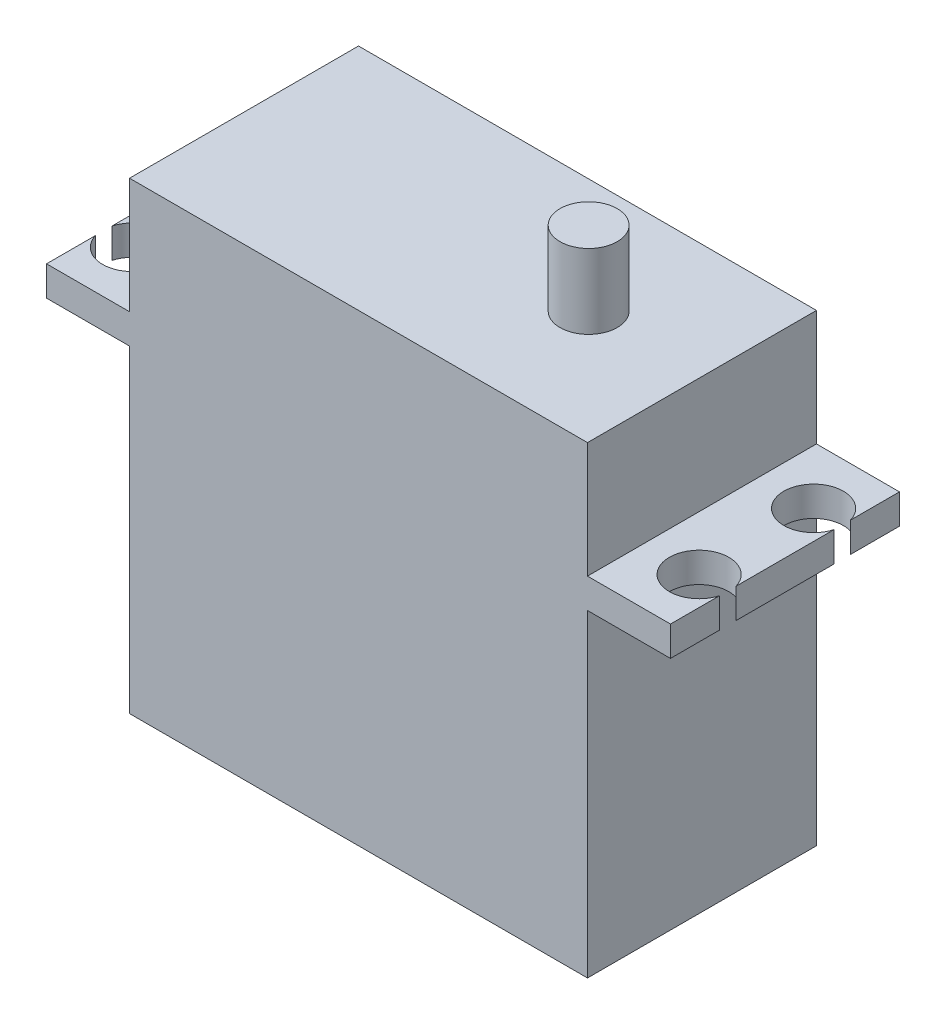
from build123d import *

# Parameters (mm, degrees)
SKETCH1_W           = 40
SKETCH1_H           = 20
BOSS_EXTRUDE1_DEPTH = 40.5
SKETCH2_R           = 2.5
BOSS_EXTRUDE2_DEPTH = 6.5
SKETCH3_W           = 20
SKETCH3_H           = 2.6
BOSS_EXTRUDE3_DEPTH = 7.25
SKETCH4_W           = 20
SKETCH4_H           = 2.6
BOSS_EXTRUDE4_DEPTH = 7.25
SKETCH5_R           = 2.6
CUT_EXTRUDE5_DEPTH  = 7.25


with BuildPart() as part:
    # Sketch1 → Boss-Extrude1 (new body)
    with BuildSketch(Plane(origin=(0, 0, 0), x_dir=(1, 0, 0), z_dir=(0, 1, 0))):
        with Locations((20, -10)):
            Rectangle(SKETCH1_W, SKETCH1_H)
    extrude(amount=BOSS_EXTRUDE1_DEPTH)

    # Sketch2 → Boss-Extrude2 (add)
    with BuildSketch(Plane(origin=(0, 40.5, 0), x_dir=(1, 0, 0), z_dir=(0, 1, 0))):
        with Locations(Location((30.1, -10, 0), (0, 0, 90))):
            Circle(SKETCH2_R)
    extrude(amount=BOSS_EXTRUDE2_DEPTH)

    # Sketch3 → Boss-Extrude3 (add)
    with BuildSketch(Plane.ZY):
        with Locations((10, 29.1)):
            Rectangle(SKETCH3_W, SKETCH3_H)
    extrude(amount=BOSS_EXTRUDE3_DEPTH)

    # Sketch4 → Boss-Extrude4 (add)
    with BuildSketch(Plane(origin=(40, 0, 0), x_dir=(0, 0, -1), z_dir=(1, 0, 0))):
        with Locations((-10, 29.1)):
            Rectangle(SKETCH4_W, SKETCH4_H)
    extrude(amount=BOSS_EXTRUDE4_DEPTH)

    # Sketch5 → Cut-Extrude5 (cut)
    with BuildSketch(Plane(origin=(0, 30.4, 0), x_dir=(1, 0, 0), z_dir=(0, 1, 0))):
        with Locations((44.75, -5)):
            Circle(SKETCH5_R)
        with Locations((44.75, -15)):
            Circle(SKETCH5_R)
        with Locations((-4.75, -15)):
            Circle(SKETCH5_R)
        with Locations((-4.75, -5)):
            Circle(SKETCH5_R)
    extrude(amount=-CUT_EXTRUDE5_DEPTH, mode=Mode.SUBTRACT)


solid = part.part
